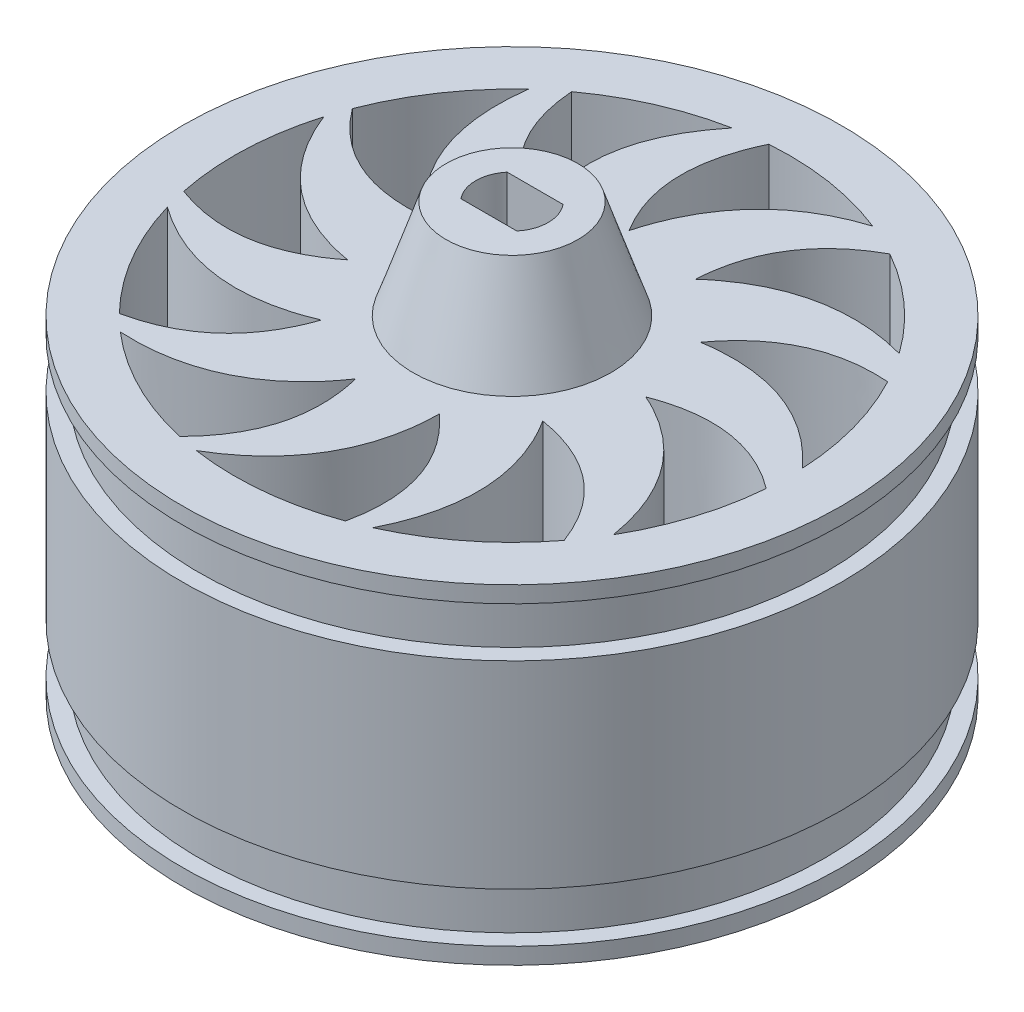
from build123d import *

# Parameters (mm, degrees)
SKETCH2_R          = 3.175
CUT_EXTRUDE1_DEPTH = 6.35
SKETCH3_R          = 1.75
CUT_EXTRUDE2_DEPTH = 19.05
CUT_EXTRUDE3_DEPTH = 7.62
CUT_EXTRUDE4_DEPTH = 44.994090512


with BuildPart() as part:
    # Sketch1 → Revolve1 (revolve)
    with BuildSketch(Plane.XY):
        Polygon((0, 33.02), (0, 25.4), (7.62, 25.4), (5.08, 33.02), align=None)
        Polygon((0, 12.7), (25.4, 12.7), (25.4, 20.32), (24.13, 20.32), (24.13, 24.13), (25.4, 24.13), (25.4, 25.4), (7.62, 25.4), (0, 25.4), align=None)
        Polygon((24.13, 5.08), (25.4, 5.08), (25.4, 12.7), (0, 12.7), (0, 0), (25.4, 0), (25.4, 1.27), (24.13, 1.27), align=None)
    revolve(axis=Axis((0, 25.4, 0), (0, 1, 0)))

    # Sketch2 → Cut-Extrude1 (cut)
    with BuildSketch(Plane.XZ):
        Circle(SKETCH2_R)
    extrude(amount=-CUT_EXTRUDE1_DEPTH, mode=Mode.SUBTRACT)

    # Sketch3 → Cut-Extrude2 (cut)
    with BuildSketch(Plane.XZ.offset(-6.35)):
        Circle(SKETCH3_R)
    extrude(amount=-CUT_EXTRUDE2_DEPTH, mode=Mode.SUBTRACT)

    # Sketch4 → Cut-Extrude3 (cut)
    with BuildSketch(Plane(origin=(0, 33.02, 0), x_dir=(1, 0, 0), z_dir=(0, 1, 0))):
        with BuildLine():
            Line((2.155261469, 1.778), (-2.155261469, 1.778))
            ThreePointArc((-2.155261469, 1.778), (-2.794, 0), (-2.155261469, -1.778))
            Line((-2.155261469, -1.778), (2.155261469, -1.778))
            Line((2.155261469, -1.778), (2.416871947, -1.401843783))
            ThreePointArc((2.416871947, -1.401843783), (2.698071183, -0.725842883), (2.794, 0))
            ThreePointArc((2.794, 0), (2.629471101, 0.944625708), (2.155261469, 1.778))
        make_face()
    extrude(amount=-CUT_EXTRUDE3_DEPTH, mode=Mode.SUBTRACT)

    # Sketch5 → Cut-Extrude4 (cut, through all)
    with BuildSketch(Plane(origin=(0, 25.4, 0), x_dir=(1, 0, 0), z_dir=(0, 1, 0))):
        with BuildLine():
            add(Edge.make_bspline(
                [(-5.845080259, 7.734265322), (-9.23601335, 14.654605478), (-4.055006065, 21.012304153)],
                knots=[0.064846702, 0.064846702, 0.064846702, 1, 1, 1], degree=2))
            ThreePointArc((-4.055006065, 21.012304153), (-8.565873017, 19.610859733), (-12.65940772, 17.253967549))
            add(Edge.make_bspline(
                [(-12.65940772, 17.253967549), (-12.175465551, 10.591188721), (-5.845080259, 7.734265322)],
                knots=[0.137557837, 0.137557837, 0.137557837, 0.92889873, 0.92889873, 0.92889873], degree=2))
        make_face()
        with BuildLine():
            add(Edge.make_bspline(
                [(7.918929549, 19.880909305), (7.874213952, 19.867029618), (6.086228092, 19.300859073), (2.591378941, 17.112469765), (0.143727725, 13.798011581), (-0.905513352, 11.180981556), (-1.173633635, 10.186171927)],
                knots=[0.182706166, 0.182706166, 0.182706166, 0.1875, 0.375, 0.625, 0.8125, 0.914749278, 0.914749278, 0.914749278], degree=2))
            ThreePointArc((7.918929549, 19.880909305), (3.266079053, 21.149296149), (-1.55264158, 21.343601011))
            add(Edge.make_bspline(
                [(-1.173633635, 10.186171927), (-4.404082185, 15.404613988), (-1.55264158, 21.343601011)],
                knots=[0, 0, 0, 1, 1, 1], degree=2))
        make_face()
        with BuildLine():
            add(Edge.make_bspline(
                [(17.441260457, 12.400098131), (17.230812806, 12.457405474), (16.448941679, 12.649966153), (14.078156888, 13.062574413), (9.968027948, 12.731125402), (6.268280286, 10.917704113), (4.758302384, 9.618485572), (4.633019063, 9.506156146)],
                knots=[0.106508434, 0.106508434, 0.106508434, 0.128269058, 0.1875, 0.375, 0.625, 0.8125, 0.829706433, 0.829706433, 0.829706433], degree=2))
            ThreePointArc((17.441260457, 12.400098131), (14.288175146, 15.931354337), (10.435852907, 18.682959458))
            add(Edge.make_bspline(
                [(10.435852907, 18.682959458), (4.996188807, 15.704859629), (4.633019063, 9.506156146)],
                knots=[0.137557837, 0.137557837, 0.137557837, 0.87218124, 0.87218124, 0.87218124], degree=2))
        make_face()
        with BuildLine():
            add(Edge.make_bspline(
                [(21.376521167, 1.002169049), (21.230464025, 1.164155645), (20.67681834, 1.74885944), (18.905460126, 3.377710624), (15.268604771, 5.320981443), (11.175769412, 5.795668978), (9.203084593, 5.519052477), (9.036959684, 5.492288228)],
                knots=[0.106508434, 0.106508434, 0.106508434, 0.128269058, 0.1875, 0.375, 0.625, 0.8125, 0.829706433, 0.829706433, 0.829706433], degree=2))
            ThreePointArc((21.376521167, 1.002169049), (20.633118251, 5.677537428), (18.8799686, 10.075057601))
            add(Edge.make_bspline(
                [(18.8799686, 10.075057601), (12.693749632, 10.510625045), (9.036959684, 5.492288228)],
                knots=[0.137557837, 0.137557837, 0.137557837, 0.87218124, 0.87218124, 0.87218124], degree=2))
        make_face()
        with BuildLine():
            ThreePointArc((18.524887445, -10.713941625), (20.427192098, -6.378857499), (21.329827662, -1.731603857))
            add(Edge.make_bspline(
                [(21.329827662, -1.731603857), (16.361134639, 1.979341273), (10.571729457, -0.265342396)],
                knots=[0.137557837, 0.137557837, 0.137557837, 0.87218124, 0.87218124, 0.87218124], degree=2))
            add(Edge.make_bspline(
                [(18.524887445, -10.713941625), (18.489592924, -10.498705377), (18.339951274, -9.707497787), (17.730413354, -7.379552421), (15.721507462, -3.778536527), (12.535030714, -1.166450108), (10.72595247, -0.332640783), (10.571729457, -0.265342396)],
                knots=[0.106508434, 0.106508434, 0.106508434, 0.128269058, 0.1875, 0.375, 0.625, 0.8125, 0.829706433, 0.829706433, 0.829706433], degree=2))
        make_face()
        with BuildLine():
            ThreePointArc((8.786105187, -19.513184149), (13.303079553, -16.7626989), (17.007617151, -12.988493325))
            add(Edge.make_bspline(
                [(17.007617151, -12.988493325), (14.7393813, -6.927608379), (8.213117387, -5.839308231)],
                knots=[0.137557837, 0.137557837, 0.137557837, 0.904150967, 0.904150967, 0.904150967], degree=2))
            add(Edge.make_bspline(
                [(8.786105187, -19.513184149), (8.902348329, -19.283391957), (9.261522909, -18.519696954), (10.132737554, -16.276518151), (10.616835615, -12.181561812), (9.567175142, -8.197237224), (8.454830824, -6.219663844), (8.213117387, -5.839308231)],
                knots=[0.102615247, 0.102615247, 0.102615247, 0.128269058, 0.1875, 0.375, 0.625, 0.8125, 0.85816819, 0.85816819, 0.85816819], degree=2))
        make_face()
        with BuildLine():
            ThreePointArc((-3.158281802, -21.165662193), (2.128663435, -21.293867473), (7.285608364, -20.121627935))
            add(Edge.make_bspline(
                [(7.285608364, -20.121627935), (8.654208733, -13.796586178), (3.752345642, -9.352685176)],
                knots=[0.137557837, 0.137557837, 0.137557837, 0.904150967, 0.904150967, 0.904150967], degree=2))
            add(Edge.make_bspline(
                [(-3.158281802, -21.165662193), (-2.936256809, -21.035194487), (-2.221215234, -20.586917806), (-0.275548814, -19.170849911), (2.345600933, -15.987676596), (3.616658854, -12.068360164), (3.750052155, -9.80334083), (3.752345642, -9.352685176)],
                knots=[0.102615247, 0.102615247, 0.102615247, 0.128269058, 0.1875, 0.375, 0.625, 0.8125, 0.85816819, 0.85816819, 0.85816819], degree=2))
        make_face()
        with BuildLine():
            ThreePointArc((-14.012656265, -16.174222219), (-9.669993515, -19.090605685), (-4.7495296, -20.866287848))
            add(Edge.make_bspline(
                [(-4.7495296, -20.866287848), (-0.301443724, -16.408347242), (-1.811811007, -10.238694387)],
                knots=[0.137557837, 0.137557837, 0.137557837, 0.883551056, 0.883551056, 0.883551056], degree=2))
            add(Edge.make_bspline(
                [(-14.012656265, -16.174222219), (-13.799253012, -16.185746726), (-12.998705964, -16.209807037), (-10.594125023, -16.115697505), (-6.645078976, -14.929083136), (-3.408280443, -12.379619507), (-2.051669436, -10.590827245), (-1.811811007, -10.238694387)],
                knots=[0.106943513, 0.106943513, 0.106943513, 0.128269058, 0.1875, 0.375, 0.625, 0.8125, 0.85571094, 0.85571094, 0.85571094], degree=2))
        make_face()
        with BuildLine():
            ThreePointArc((-20.53264131, -6.030807644), (-18.45607687, -10.832046278), (-15.276725475, -14.986048804))
            add(Edge.make_bspline(
                [(-15.276725475, -14.986048804), (-9.124612863, -13.640607304), (-7.059648513, -7.63379884)],
                knots=[0.137557837, 0.137557837, 0.137557837, 0.883551056, 0.883551056, 0.883551056], degree=2))
            add(Edge.make_bspline(
                [(-20.53264131, -6.030807644), (-20.359345688, -6.155877186), (-19.698890641, -6.608926418), (-17.625148976, -7.829771047), (-13.661467875, -8.966543001), (-9.560155574, -8.571743121), (-7.451807661, -7.800354595), (-7.059648513, -7.63379884)],
                knots=[0.106943513, 0.106943513, 0.106943513, 0.128269058, 0.1875, 0.375, 0.625, 0.8125, 0.85571094, 0.85571094, 0.85571094], degree=2))
        make_face()
        with BuildLine():
            add(Edge.make_bspline(
                [(-20.533657815, 6.027345745), (-20.45548996, 5.828439865), (-20.144816726, 5.090241642), (-19.060312663, 2.942052395), (-16.340437251, -0.157188817), (-12.676748859, -2.042398858), (-10.486049605, -2.533324475), (-10.066097498, -2.6052261)],
                knots=[0.106943513, 0.106943513, 0.106943513, 0.128269058, 0.1875, 0.375, 0.625, 0.8125, 0.85571094, 0.85571094, 0.85571094], degree=2))
            ThreePointArc((-20.533657815, 6.027345745), (-21.382486224, 0.865611287), (-20.953668952, -4.347845151))
            add(Edge.make_bspline(
                [(-20.953668952, -4.347845151), (-15.05078189, -6.542070927), (-10.066097498, -2.6052261)],
                knots=[0.137557837, 0.137557837, 0.137557837, 0.883551056, 0.883551056, 0.883551056], degree=2))
        make_face()
        with BuildLine():
            add(Edge.make_bspline(
                [(-14.488329518, 15.749549447), (-14.556434549, 15.232480936), (-14.637756577, 14.135394512), (-14.649368911, 11.729000684), (-13.637377979, 7.731639966), (-11.246211055, 4.404955364), (-9.865752035, 3.25155329)],
                knots=[0.076850809, 0.076850809, 0.076850809, 0.128269058, 0.1875, 0.375, 0.625, 0.810017423, 0.810017423, 0.810017423], degree=2))
            ThreePointArc((-14.488329518, 15.749549447), (-17.70022982, 12.027546064), (-19.977970588, 7.670768618))
            add(Edge.make_bspline(
                [(-19.977970588, 7.670768618), (-16.195182344, 2.629193031), (-9.865752035, 3.25155329)],
                knots=[0.137557837, 0.137557837, 0.137557837, 0.88419286, 0.88419286, 0.88419286], degree=2))
        make_face()
    extrude(amount=-CUT_EXTRUDE4_DEPTH, mode=Mode.SUBTRACT)


solid = part.part
